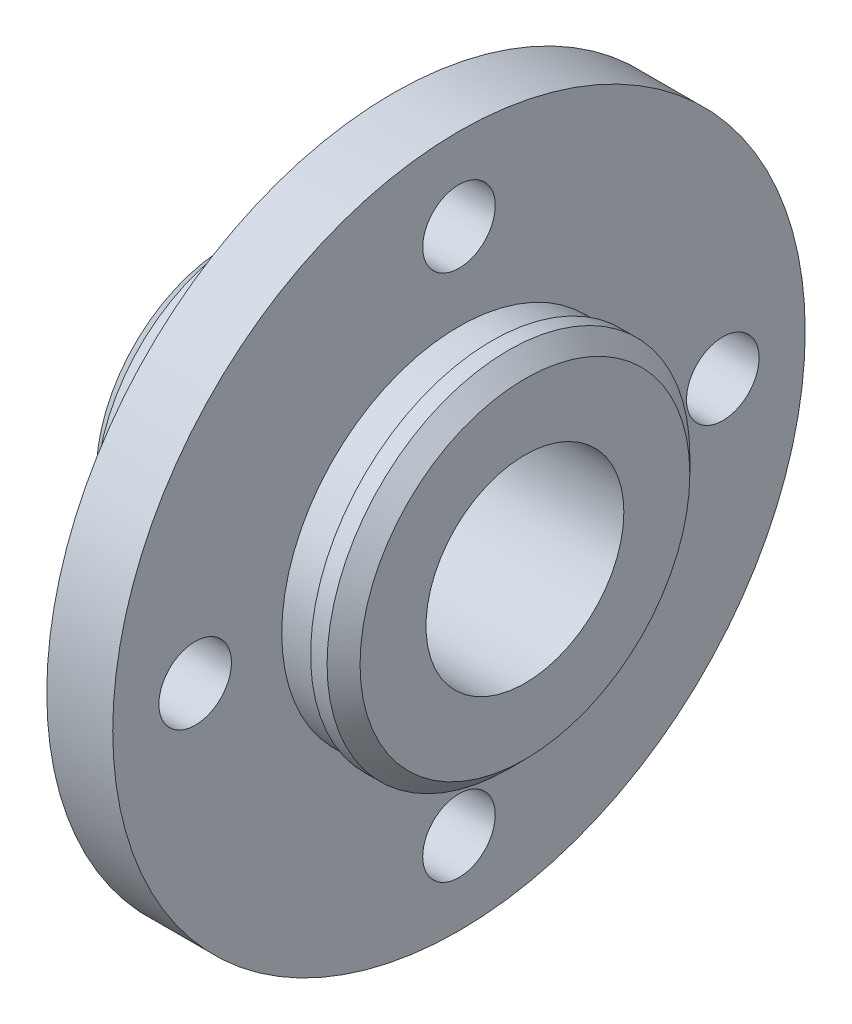
from build123d import *

# Parameters (mm, degrees)
SKETCH_2_R               = 2.2
CUT_EXTRUDE_1_DEPTH      = 33.832910319
PATTERN_CIRCULAR_1_COUNT = 4
FILLET_1_R               = 1
CHAMFER_1_SIZE           = 1


with BuildPart() as part:
    # Эскиз1 → Повернуть1 (revolve)
    with BuildSketch(Plane.XY, mode=Mode.PRIVATE) as revolve_1_sk:
        Polygon((0, -6), (0, -11), (-2, -11), (-2, -10.75), (-4, -10.75), (-4, -21), (-8, -21), (-8, -9), (-18, -9), (-18, -6), align=None)
    revolve(revolve_1_sk.sketch.rotate(Axis((0, 0, 0), (-1, 0, 0)), 270), axis=Axis((0, 0, 0), (-1, 0, 0)))

    # Эскиз2 → Вырез-Вытянуть1 (cut, through all)
    with BuildSketch(Plane(origin=(-4, 0, 0), x_dir=(0, 0, -1), z_dir=(1, 0, 0))):
        with Locations((0, 16)):
            Circle(SKETCH_2_R)
    cut_extrude_1 = extrude(amount=-CUT_EXTRUDE_1_DEPTH, mode=Mode.SUBTRACT)

    # Круговой массив1: Вырез-Вытянуть1 ×4 about axis
    pattern_circular_1_axis = Axis((0, 0, 0), (1, 0, 0))
    for i in range(1, PATTERN_CIRCULAR_1_COUNT):
        add(cut_extrude_1.rotate(pattern_circular_1_axis, i * 360 / PATTERN_CIRCULAR_1_COUNT), mode=Mode.SUBTRACT)

    # Скругление1
    fillet_1_edges = [part.edges().sort_by_distance(p)[0] for p in [
        (-8, 0, 9),
    ]]
    fillet(fillet_1_edges, radius=FILLET_1_R)

    # Фаска1
    chamfer_1_edges = [part.edges().sort_by_distance(p)[0] for p in [
        (0, 0, 11),
        (-18, 0, 9),
    ]]
    chamfer(chamfer_1_edges, length=CHAMFER_1_SIZE)


solid = part.part
